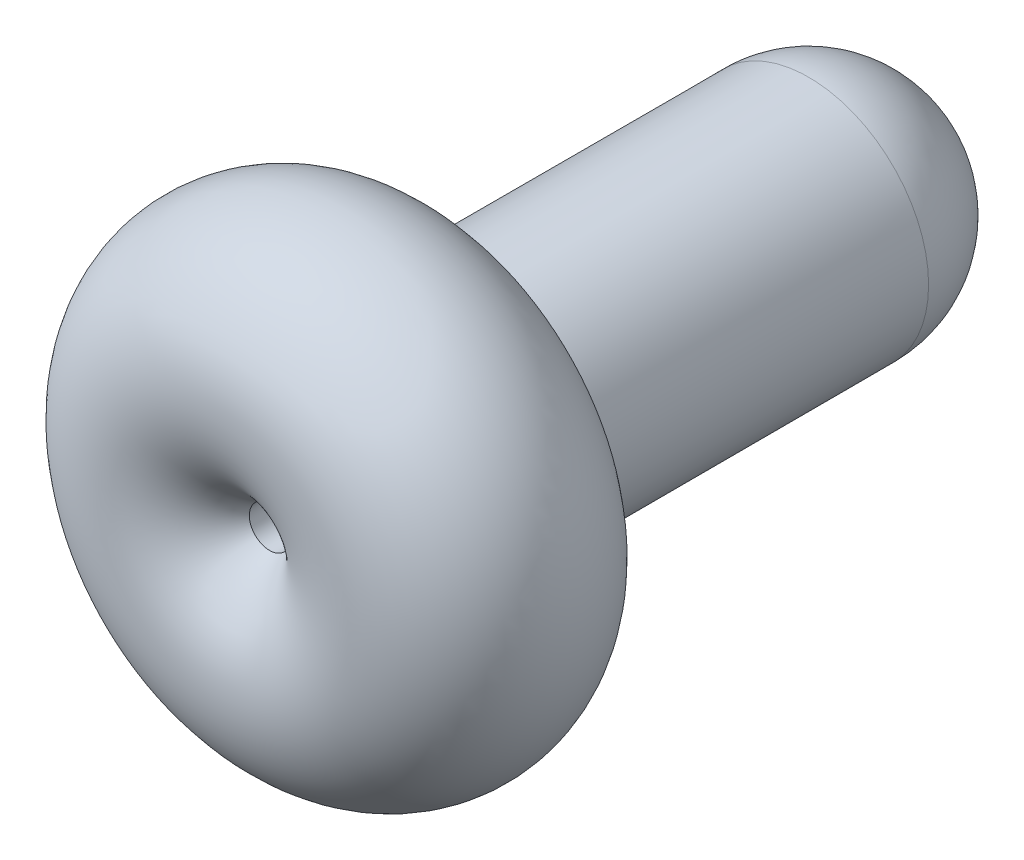
from build123d import *

# Parameters (mm, degrees)
SKETCH2_R          = 5
CUT_EXTRUDE1_DEPTH = 50


with BuildPart() as part:
    # Sketch1 → Revolve1 (revolve)
    with BuildSketch(Plane(origin=(0, 0, 0), x_dir=(1, 0, 0), z_dir=(0, 1, 0)), mode=Mode.PRIVATE) as revolve1_sk:
        with BuildLine():
            Line((-29.729607451, 29.729607451), (-29.729607451, 116.729644054))
            ThreePointArc((-29.729607451, 116.729644054), (-21.058440505, 137.663692897), (-0.124391663, 146.334859843))
            Line((-0.124391663, 146.334859843), (0, 0))
            ThreePointArc((0, 0), (-50.751614482, -21.022007031), (-29.729607451, 29.729607451))
        make_face()
    revolve(revolve1_sk.sketch.rotate(Axis((0, 0, 0), (-0.0008500477478021908, 0, -0.999999638709348)), 180), axis=Axis((0, 0, 0), (-0.0008500477478021908, 0, -0.999999638709348)))

    # Sketch2 → Cut-Extrude1 (cut, symmetric)
    with BuildSketch(Plane.XY):
        Circle(SKETCH2_R)
    extrude(amount=CUT_EXTRUDE1_DEPTH, both=True, mode=Mode.SUBTRACT)


solid = part.part
